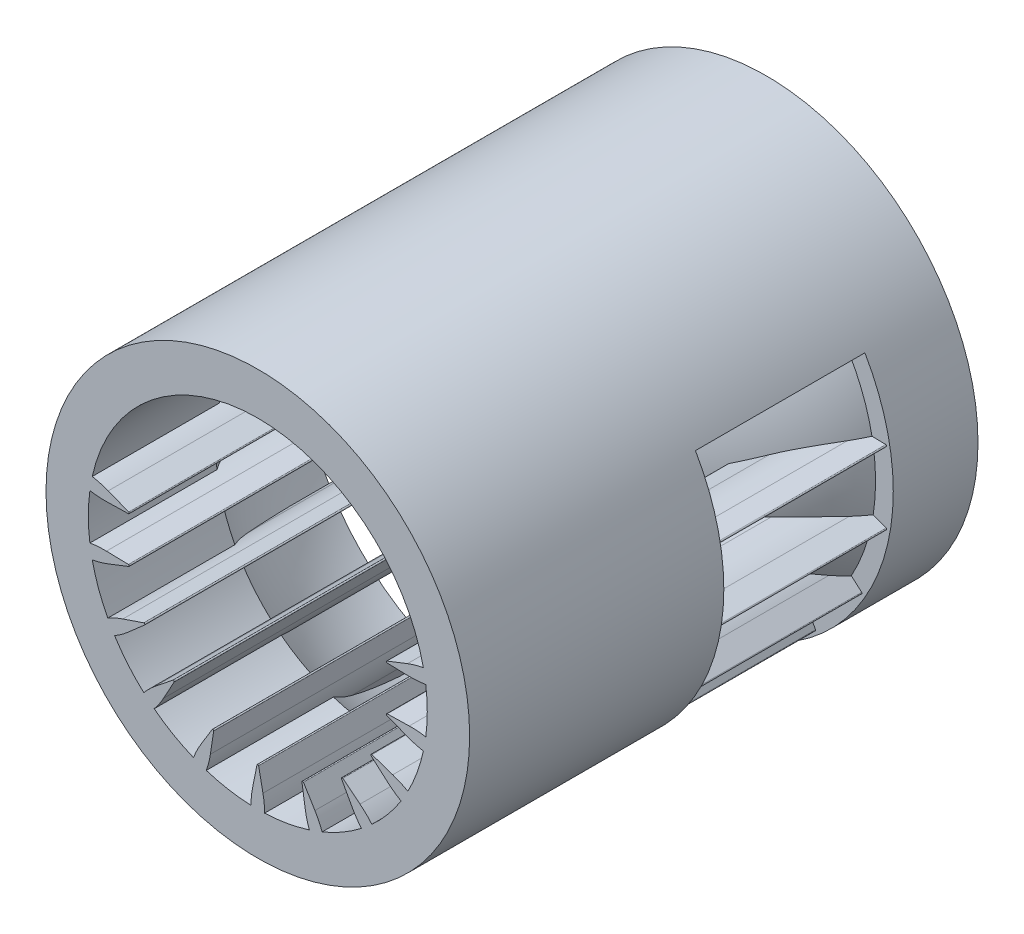
from build123d import *

# Parameters (mm, degrees)
SKETCH_1_R               = 25
SKETCH_1_R_2             = 20
EXTRUDE_1_DEPTH          = 10
EXTRUDE_2_DEPTH          = 50
EXTRUDE_3_DEPTH          = 50
PATTERN_CIRCULAR_1_COUNT = 6
PATTERN_CIRCULAR_1_ANGLE = 100
F_1_THE_OTHER_WAY_COUNT  = 6
F_1_THE_OTHER_WAY_ANGLE  = 100


with BuildPart() as part:
    # 草图1 → 凸台-拉伸1 (new body)
    with BuildSketch(Plane.XY):
        Circle(SKETCH_1_R)
        Circle(SKETCH_1_R_2, mode=Mode.SUBTRACT)
    extrude(amount=EXTRUDE_1_DEPTH)

    # 草图2 → 凸台-拉伸2 (add)
    with BuildSketch(Plane.XY.offset(10)):
        with BuildLine():
            Line((-21.650635095, 12.5), (-17.320508076, 10))
            ThreePointArc((-17.320508076, 10), (0, 20), (17.320508076, 10))
            Line((17.320508076, 10), (21.650635095, 12.5))
            ThreePointArc((21.650635095, 12.5), (0, 25), (-21.650635095, 12.5))
        make_face()
    extrude(amount=EXTRUDE_2_DEPTH)

    # 草图3 → 旋转1 (revolve)
    with BuildSketch(Plane(origin=(0, 0, 0), x_dir=(0, 0, -1), z_dir=(1, 0, 0)), mode=Mode.PRIVATE) as revolve_1_sk:
        with BuildLine():
            Line((-19.843134833, -2.5), (-24.874685928, -2.5))
            ThreePointArc((-24.874685928, -2.5), (-16.770509831, -18.540496218), (0, -25))
            Line((0, -25), (0, -20))
            ThreePointArc((0, -20), (-13.228756555, -15), (-19.843134833, -2.5))
        make_face()
        with BuildLine():
            ThreePointArc((-45, -20), (-37.90569415, -23.717082451), (-30, -25))
            Line((-30, -25), (-60, -25))
            Line((-60, -25), (-60, -20))
            Line((-60, -20), (-45, -20))
        make_face()
    revolve(revolve_1_sk.sketch.rotate(Axis((0, 0, 25), (0, 0, -1)), 270), axis=Axis((0, 0, 25), (0, 0, -1)))

    # 草图4 → 凸台-拉伸3 (add)
    with BuildSketch(Plane.XY.offset(10)):
        with BuildLine():
            Line((-0.098058068, -15.490290338), (-0.60776773, -18.038838649))
            ThreePointArc((-0.60776773, -18.038838649), (-0.801960973, -20), (-0.60776773, -21.961161351))
            Line((-0.60776773, -21.961161351), (-0.098058068, -24.509709662))
            ThreePointArc((-0.098058068, -24.509709662), (0, -24.590098049), (0.098058068, -24.509709662))
            Line((0.098058068, -24.509709662), (0.60776773, -21.961161351))
            ThreePointArc((0.60776773, -21.961161351), (0.801960973, -20), (0.60776773, -18.038838649))
            Line((0.60776773, -18.038838649), (0.098058068, -15.490290338))
            ThreePointArc((0.098058068, -15.490290338), (0, -15.409901951), (-0.098058068, -15.490290338))
        make_face()
    extrude_3 = extrude(amount=EXTRUDE_3_DEPTH)

    # 阵列(圆周)1: 凸台-拉伸3 ×6 about axis
    pattern_circular_1_axis = Axis((0, 0, 0), (0, 0, 1))
    for i in range(1, PATTERN_CIRCULAR_1_COUNT):
        add(extrude_3.rotate(pattern_circular_1_axis, i * PATTERN_CIRCULAR_1_ANGLE / (PATTERN_CIRCULAR_1_COUNT - 1)))

    # 1 the other way: 凸台-拉伸3 ×6 about axis
    f_1_the_other_way_axis = Axis((0, 0, 0), (0, 0, -1))
    for i in range(1, F_1_THE_OTHER_WAY_COUNT):
        add(extrude_3.rotate(f_1_the_other_way_axis, i * F_1_THE_OTHER_WAY_ANGLE / (F_1_THE_OTHER_WAY_COUNT - 1)))

    # 草图5 one side → 切除-旋转3 (revolve, cut)
    with BuildSketch(Plane(origin=(0, 0, 0), x_dir=(0, 0, -1), z_dir=(1, 0, 0))):
        with BuildLine():
            Line((-20, 0), (20, 0))
            ThreePointArc((20, 0), (0, 20), (-20, 0))
        make_face()
    revolve(axis=Axis((0, 0, 0), (0, 0, -1)), mode=Mode.SUBTRACT)


solid = part.part
